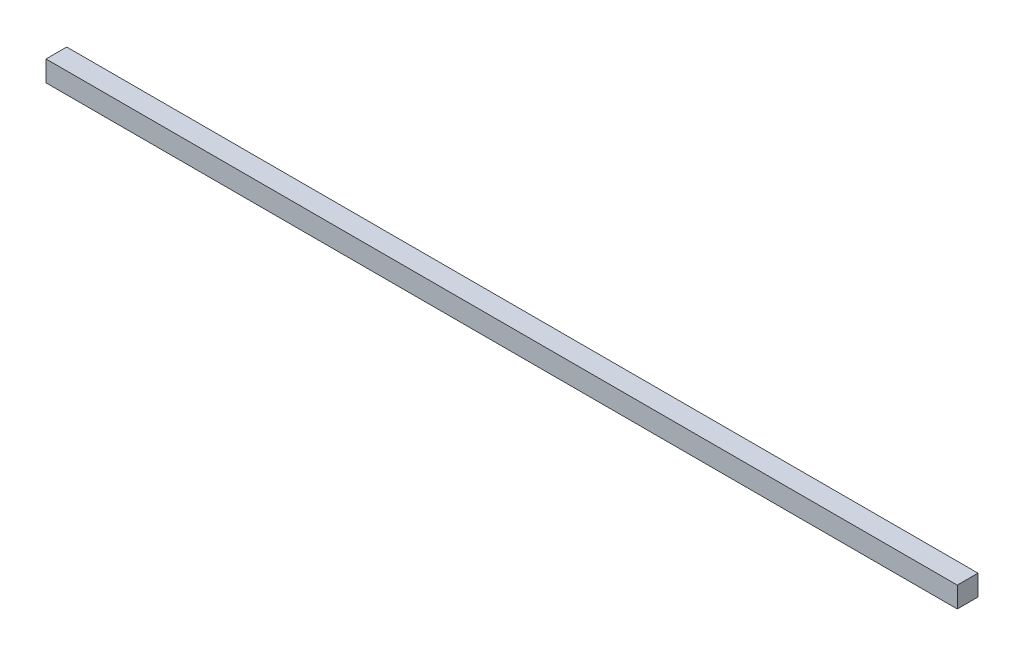
from build123d import *

# Parameters (mm, degrees)
SKETCH1_W     = 132
SKETCH1_H     = 3
PROFILE_DEPTH = 3


with BuildPart() as part:
    # Sketch1 → Profile (new body)
    with BuildSketch(Plane.XY):
        with Locations((66, 1.5)):
            Rectangle(SKETCH1_W, SKETCH1_H)
    extrude(amount=PROFILE_DEPTH)


solid = part.part
